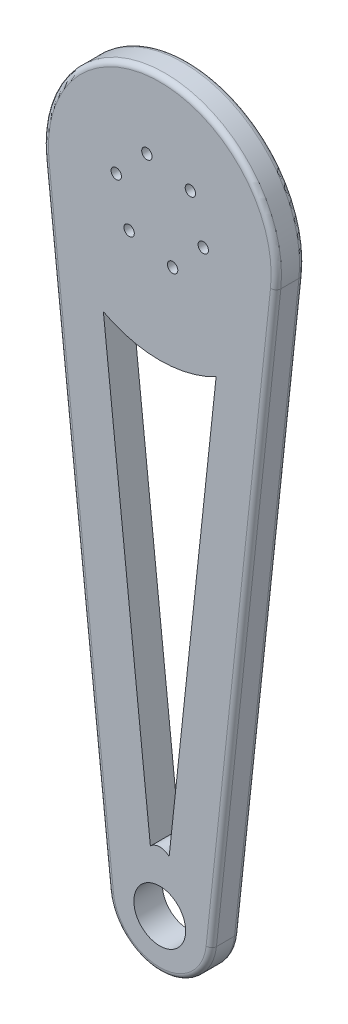
from build123d import *

# Parameters (mm, degrees)
EXTRUDE_1_DEPTH     = 11
SKETCH_2_R          = 10
CUT_EXTRUDE_1_DEPTH = 11
FILLET_1_R          = 2
CUT_EXTRUDE_2_DEPTH = 20
SKETCH_6_R          = 2
CUT_EXTRUDE_4_DEPTH = 33


with BuildPart() as part:
    # 草图1 → 凸台-拉伸1 (new body)
    with BuildSketch(Plane.XY):
        with BuildLine():
            Line((-44.744635323, -4.787234043), (-19.886504588, -237.127659574))
            ThreePointArc((-19.886504588, -237.127659574), (0, -255), (19.886504588, -237.127659574))
            Line((19.886504588, -237.127659574), (44.744635323, -4.787234043))
            ThreePointArc((44.744635323, -4.787234043), (0, 45), (-44.744635323, -4.787234043))
        make_face()
    extrude(amount=EXTRUDE_1_DEPTH)

    # 草图2 → 切除-拉伸1 (cut)
    with BuildSketch(Plane(origin=(0, 0, 0), x_dir=(-1, 0, 0), z_dir=(0, 0, -1))):
        with Locations((0, -235.836034695)):
            Circle(SKETCH_2_R)
    extrude(amount=-CUT_EXTRUDE_1_DEPTH, mode=Mode.SUBTRACT)

    # 圆角1
    fillet_1_edges = [part.edges().sort_by_distance(p)[0] for p in [
        (0, -255, 11),
        (32.315569956, -120.957446809, 11),
        (0, 45, 11),
        (32.315569956, -120.957446809, 0),
        (0, -255, 0),
        (-32.315569956, -120.957446809, 0),
        (0, 45, 0),
        (-32.315569956, -120.957446809, 11),
    ]]
    fillet(fillet_1_edges, radius=FILLET_1_R)

    # 草图4 → 切除-拉伸2 (cut)
    with BuildSketch(Plane(origin=(0, 0, 0), x_dir=(-1, 0, 0), z_dir=(0, 0, -1))):
        with BuildLine():
            Line((-21.759824224, -44.682312886), (-3.625991278, -214.173032358))
            ThreePointArc((-3.625991278, -214.173032358), (0.015295132, -212.723088949), (3.615338262, -214.272602446))
            Line((3.615338262, -214.272602446), (21.759824224, -44.682312886))
            ThreePointArc((21.759824224, -44.682312886), (0, -50.060383894), (-21.759824224, -44.682312886))
        make_face()
    extrude(amount=-CUT_EXTRUDE_2_DEPTH, mode=Mode.SUBTRACT)

    # 草图6 → 切除-拉伸4 (cut)
    with BuildSketch(Plane.XY.offset(11)):
        with Locations((-16.789244382, 3.960274368)):
            Circle(SKETCH_6_R)
        with Locations((-4.964923982, 16.52004933)):
            Circle(SKETCH_6_R)
        with Locations((11.8243204, 12.559774961)):
            Circle(SKETCH_6_R)
        with Locations((16.789244382, -3.960274368)):
            Circle(SKETCH_6_R)
        with Locations((4.964923982, -16.52004933)):
            Circle(SKETCH_6_R)
        with Locations((-11.8243204, -12.559774961)):
            Circle(SKETCH_6_R)
    extrude(amount=-CUT_EXTRUDE_4_DEPTH, mode=Mode.SUBTRACT)


solid = part.part
